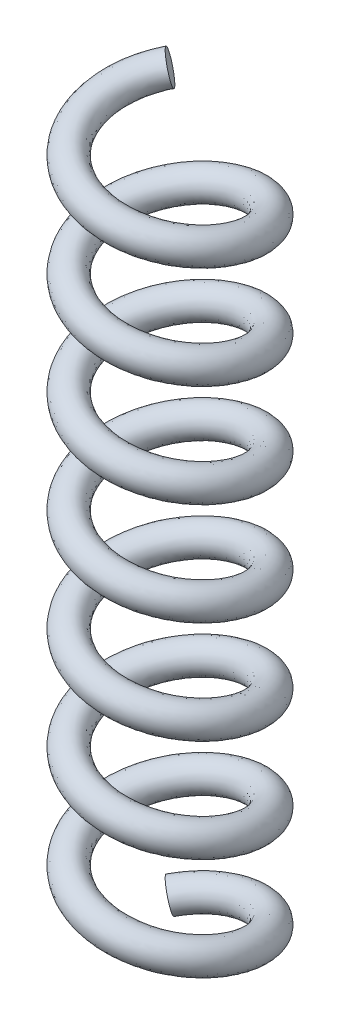
from build123d import *

# Parameters (mm, degrees)
SWEEP_1_PITCH       = 5
SWEEP_1_HEIGHT      = 35
SWEEP_1_RADIUS      = 3.5
SWEEP_1_START_ANGLE = -135
SKETCH_3_R          = 0.75


with BuildPart() as part:
    # 扫描1: sweep along a helix
    with BuildLine() as sweep_1_path:
        add(Helix(SWEEP_1_PITCH, SWEEP_1_HEIGHT, SWEEP_1_RADIUS, center=(0, 0, 0), direction=(0, 1, 0), lefthand=True, mode=Mode.PRIVATE).rotate(Axis((0, 0, 0), (0, 1, 0)), SWEEP_1_START_ANGLE))
    # 草图3 → 扫描1 (sweep)
    with BuildSketch(Plane(origin=(-2.474873734, 0, -2.474873734), x_dir=(-0.7228727027208196, 0.151406357908533, -0.6741892690083184), z_dir=(0.6895094212798698, 0.22170592218654045, -0.6895094212798799))):
        Circle(SKETCH_3_R)
    sweep(path=sweep_1_path.line, is_frenet=True)


solid = part.part
